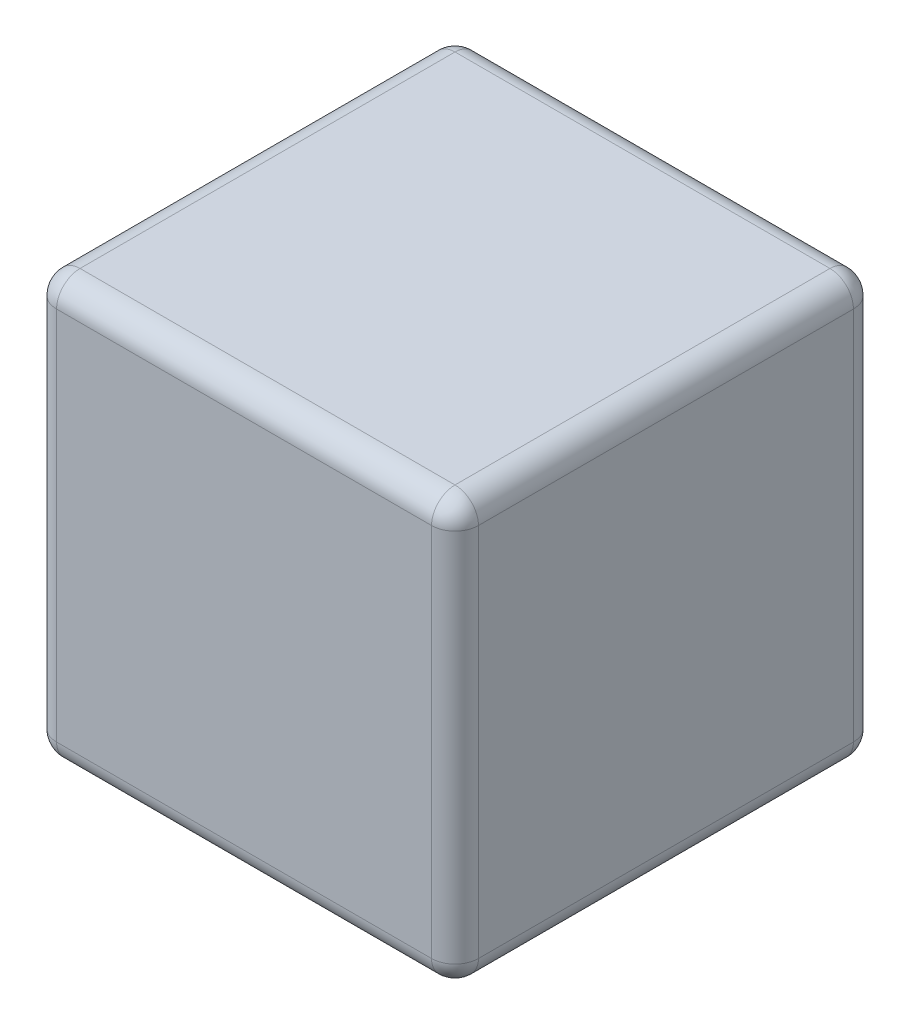
from build123d import *

# Parameters (mm, degrees)
SKETCH_1_W      = 18
SKETCH_1_H      = 18
EXTRUDE_1_DEPTH = 18
FILLET_1_R      = 1


with BuildPart() as part:
    # 草图1 → 凸台-拉伸1 (new body)
    with BuildSketch(Plane(origin=(0, 0, 0), x_dir=(1, 0, 0), z_dir=(0, 1, 0))):
        with Locations((9, 9)):
            Rectangle(SKETCH_1_W, SKETCH_1_H)
    extrude(amount=EXTRUDE_1_DEPTH)

    # 圆角1
    fillet_1_edges = [part.edges().sort_by_distance(p)[0] for p in [
        (18, 18, -9),
        (9, 18, -18),
        (0, 18, -9),
        (9, 0, -18),
        (18, 0, -9),
        (9, 0, 0),
        (0, 0, -9),
        (0, 9, -18),
        (18, 9, -18),
        (18, 9, 0),
        (0, 9, 0),
        (9, 18, 0),
    ]]
    fillet(fillet_1_edges, radius=FILLET_1_R)


solid = part.part
